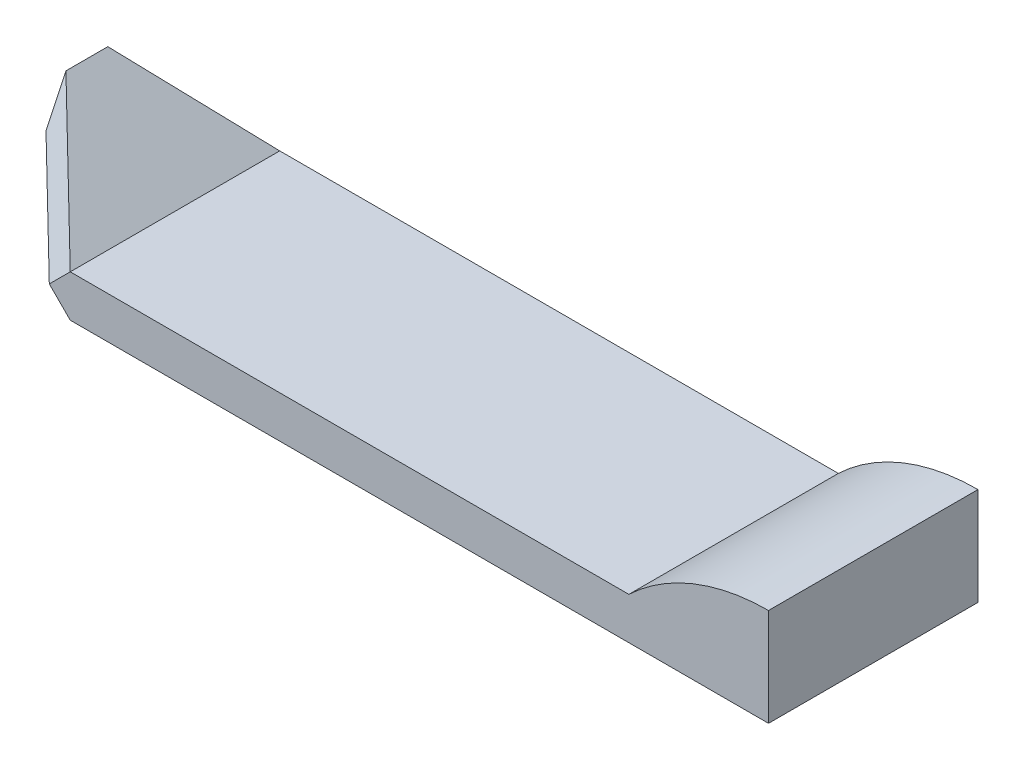
from build123d import *

# Parameters (mm, degrees)
SKETCH1_W           = 250
SKETCH1_H           = 75
BOSS_EXTRUDE1_DEPTH = 15
BOSS_EXTRUDE2_DEPTH = 37.5
BOSS_EXTRUDE3_DEPTH = 75
CUT_EXTRUDE1_DEPTH  = 75


with BuildPart() as part:
    # Sketch1 → Boss-Extrude1 (new body)
    with BuildSketch(Plane(origin=(0, 0, 0), x_dir=(1, 0, 0), z_dir=(0, 1, 0))):
        Rectangle(SKETCH1_W, SKETCH1_H)
    extrude(amount=BOSS_EXTRUDE1_DEPTH)

    # Sketch3 → Boss-Extrude2 (add)
    with BuildSketch(Plane.XY):
        with BuildLine():
            Line((125, 15), (125, 35))
            ThreePointArc((125, 35), (98.074175964, 29.814560089), (75, 15))
            Line((75, 15), (125, 15))
        make_face()
    boss_extrude2 = extrude(amount=BOSS_EXTRUDE2_DEPTH)

    # Mirror1: Boss-Extrude2 across plane
    add(boss_extrude2.mirror(Plane(origin=(125, -37.5, 0), x_dir=(1, 0, 0), z_dir=(0, 0, 1))))

    # Sketch6 → Boss-Extrude3 (add)
    with BuildSketch(Plane.XY.offset(37.5)):
        Polygon((-125, 0), (-125, 15), (-156.545603012, 46.545603012), (-156.545603012, 31.545603012), align=None)
    extrude(amount=-BOSS_EXTRUDE3_DEPTH)

    # Sketch7 → Cut-Extrude1 (cut)
    with BuildSketch(Plane(origin=(-55, -55, 0), x_dir=(0, 0, -1), z_dir=(0.7071067811865438, 0.7071067811865513, 0))):
        Polygon((-37.5, 98.994949366), (-7.5, 143.607168979), (-37.5, 143.607168979), align=None)
        Polygon((7.5, 143.607168979), (37.5, 98.994949366), (37.5, 143.607168979), align=None)
    extrude(amount=-CUT_EXTRUDE1_DEPTH, mode=Mode.SUBTRACT)


solid = part.part
